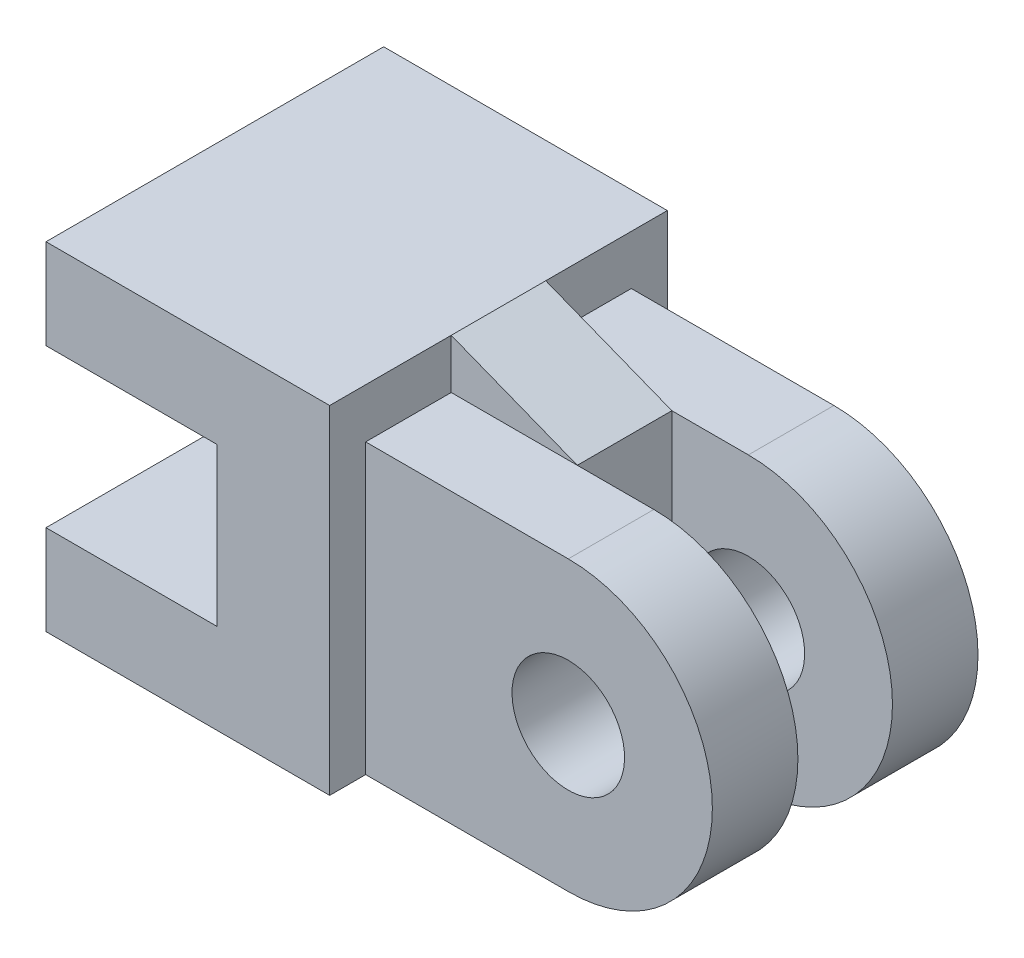
from build123d import *

# Parameters (mm, degrees)
Y_KSEKLIK_EKSTR_ZYON1_DEPTH = 75
IZIM3_W                     = 19
IZIM3_H                     = 64
Y_KSEKLIK_EKSTR_ZYON6_DEPTH = 77
RADYUS1_RADIUS              = 32
RADYUS1_LENGTH              = 19
RADYUS2_RADIUS              = 32
RADYUS2_LENGTH              = 19
KES_EKSTR_ZYON1_DEPTH       = 120.031428784
KES_EKSTR_ZYON1_DEPTH_BACK  = 120.031428784
IZIM4_R                     = 12.5
IZIM6_W                     = 21
IZIM6_H                     = 75
Y_KSEKLIK_EKSTR_ZYON7_DEPTH = 28
KES_EKSTR_ZYON3_REACH       = 111.469


with BuildPart() as part:
    # Çizim1 → Yükseklik-Ekstrüzyon1 (new body)
    with BuildSketch(Plane.XY):
        Polygon((-87.576185102, -10.168171558), (-87.576185102, -30.168171558), (-24.576185102, -30.168171558), (-24.576185102, 44.831828442), (-87.576185102, 44.831828442), (-87.576185102, 24.831828442), (-49.576185102, 24.831828442), (-49.576185102, -10.168171558), align=None)
    extrude(amount=Y_KSEKLIK_EKSTR_ZYON1_DEPTH)

    # Çizim3 → Yükseklik-Ekstrüzyon6 (add)
    with BuildSketch(Plane(origin=(-24.576185102, 0, 0), x_dir=(0, 0, -1), z_dir=(1, 0, 0))):
        with Locations((-57.5, 1.831828442)):
            Rectangle(IZIM3_W, IZIM3_H)
        with Locations((-17.5, 1.831828442)):
            Rectangle(IZIM3_W, IZIM3_H)
    extrude(amount=Y_KSEKLIK_EKSTR_ZYON6_DEPTH)

    # Radyus1: full round fillet: the end face becomes a half cylinder, R = half its width
    radyus1_face = Plane((52.423814898, 1.831828442, 57.5), x_dir=(0, 0, 1), z_dir=(1, 0, 0))  # on the end face: x along it, z out of the body
    radyus1_slab = radyus1_face.offset(-RADYUS1_RADIUS / 2) * Box(RADYUS1_LENGTH, 2 * RADYUS1_RADIUS, RADYUS1_RADIUS, mode=Mode.PRIVATE)  # the body's end, R deep
    radyus1_round = Plane((20.423814898, 1.831828442, 57.5), x_dir=(1, 0, 0), z_dir=(0, 0, 1)) * Cylinder(RADYUS1_RADIUS, RADYUS1_LENGTH, mode=Mode.PRIVATE)  # its axis R under the face
    add(radyus1_slab - radyus1_round, mode=Mode.SUBTRACT)

    # Radyus2: full round fillet: the end face becomes a half cylinder, R = half its width
    radyus2_face = Plane((52.423814898, 1.831828442, 17.5), x_dir=(0, 0, 1), z_dir=(1, 0, 0))  # on the end face: x along it, z out of the body
    radyus2_slab = radyus2_face.offset(-RADYUS2_RADIUS / 2) * Box(RADYUS2_LENGTH, 2 * RADYUS2_RADIUS, RADYUS2_RADIUS, mode=Mode.PRIVATE)  # the body's end, R deep
    radyus2_round = Plane((20.423814898, 1.831828442, 17.5), x_dir=(1, 0, 0), z_dir=(0, 0, 1)) * Cylinder(RADYUS2_RADIUS, RADYUS2_LENGTH, mode=Mode.PRIVATE)  # its axis R under the face
    add(radyus2_slab - radyus2_round, mode=Mode.SUBTRACT)

    # Çizim4 → Kes-Ekstrüzyon1 (cut, two sides: drawn at the far end of the back side and taken through both)
    with BuildSketch(Plane.XY.offset(67).offset(-KES_EKSTR_ZYON1_DEPTH_BACK)):
        with Locations(Location((20.423814898, 1.831828442, 0), (0, 0, 90))):
            Circle(IZIM4_R)
    extrude(amount=KES_EKSTR_ZYON1_DEPTH + KES_EKSTR_ZYON1_DEPTH_BACK, mode=Mode.SUBTRACT)

    # Çizim6 → Yükseklik-Ekstrüzyon7 (add)
    with BuildSketch(Plane(origin=(-24.576185102, 0, 0), x_dir=(0, 0, -1), z_dir=(1, 0, 0))):
        with Locations((-37.5, 7.331828442)):
            Rectangle(IZIM6_W, IZIM6_H)
    extrude(amount=Y_KSEKLIK_EKSTR_ZYON7_DEPTH)

    # Çizim7 → Kes-Ekstrüzyon3 (cut, up to next)
    with BuildSketch(Plane.XY.offset(48), mode=Mode.PRIVATE) as kes_ekstr_zyon3_sk1:
        Polygon((-24.576185102, 44.831828442), (3.423814898, 33.831828442), (3.423814898, 44.831828442), align=None)
    kes_ekstr_zyon3_tool1 = extrude(kes_ekstr_zyon3_sk1.sketch, amount=-KES_EKSTR_ZYON3_REACH, mode=Mode.PRIVATE) & part.part
    add(kes_ekstr_zyon3_tool1.solids().sort_by_distance((-5.909518, 41.165162, 48))[0], mode=Mode.SUBTRACT)


solid = part.part
